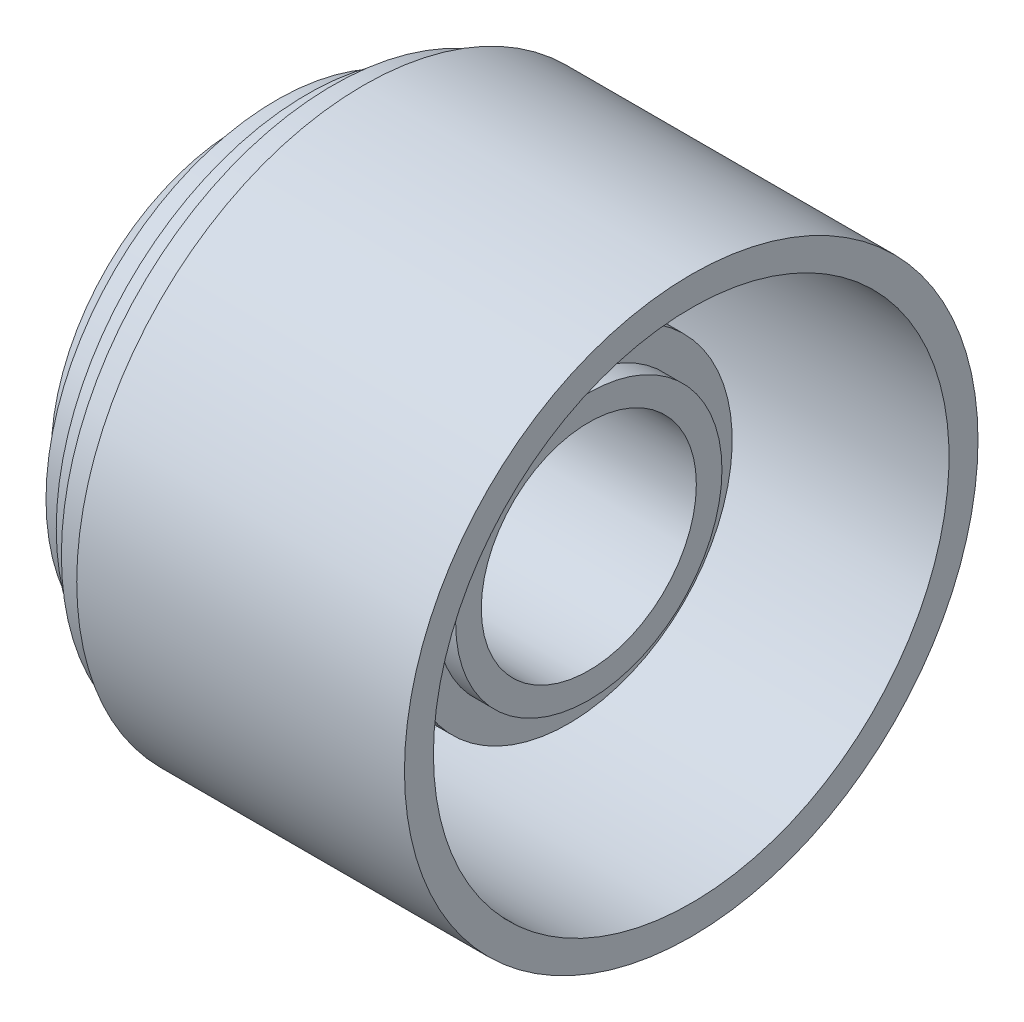
from build123d import *


with BuildPart() as part:
    # Esquisse1 → Révolution1 (revolve)
    with BuildSketch(Plane.XY):
        Polygon((0, 10.5), (-18, 10.5), (-21, 13), (0, 13), align=None)
    revolve(axis=Axis((-90.5, 0, 0), (1, 0, 0)))

    # Esquisse2 → Révolution4 (revolve)
    with BuildSketch(Plane.XY):
        with BuildLine():
            Line((-2, 13), (-2, 16))
            Line((-2, 16), (-22, 16))
            ThreePointArc((-22, 16), (-25.050730834, 18.263813026), (-23.768106875, 21.839660313))
            Line((-23.768106875, 21.839660313), (-20.027737076, 24.33324018))
            ThreePointArc((-20.027737076, 24.33324018), (-18.703156838, 24.95844884), (-17.254236095, 25.172988708))
            Line((-17.254236095, 25.172988708), (10, 25.172988708))
            Line((10, 25.172988708), (10, 28))
            Line((10, 28), (-22, 28))
            Line((-22, 28), (-22, 26.5))
            Line((-22, 26.5), (-25, 26.5))
            Line((-25, 26.5), (-25, 24.5))
            Line((-25, 24.5), (-27.5, 24.5))
            Line((-27.5, 24.5), (-27.5, 22.5))
            Line((-27.5, 22.5), (-30.5, 22.5))
            Line((-30.5, 22.5), (-30.5, 20.672988708))
            Line((-30.5, 20.672988708), (-34, 18.5))
            Line((-34, 18.5), (-34, 16))
            Line((-34, 16), (-29, 16))
            Line((-29, 16), (-29, 14.5))
            Line((-29, 14.5), (-27, 14.5))
            Line((-27, 14.5), (-27, 13))
            Line((-27, 13), (-2, 13))
        make_face()
    revolve(axis=Axis((-35.5, 0, 0), (1, 0, 0)))


solid = part.part
